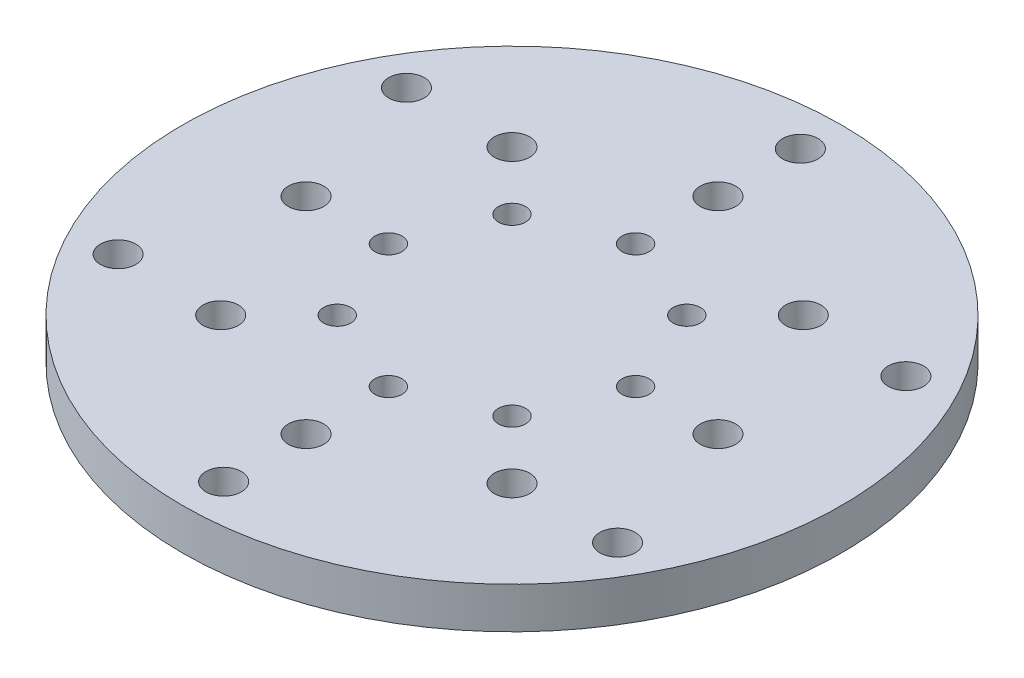
from build123d import *

# Parameters (mm, degrees)
SKETCH_1_R      = 40
SKETCH_1_R_2    = 2.15
SKETCH_1_R_3    = 1.65
EXTRUDE_2_DEPTH = 5


with BuildPart() as part:
    # 草图1 → 凸台-拉伸2 (new body)
    with BuildSketch(Plane(origin=(0, 0, 0), x_dir=(1, 0, 0), z_dir=(0, 1, 0))):
        with Locations(Location((0, 0, 0), (0, 0, 270))):
            Circle(SKETCH_1_R)
        with Locations(Location((0, 35, 0), (0, 0, 270))):
            Circle(SKETCH_1_R_2, mode=Mode.SUBTRACT)
        with Locations(Location((30.310889132, 17.5, 0), (0, 0, 270))):
            Circle(SKETCH_1_R_2, mode=Mode.SUBTRACT)
        with Locations(Location((30.310889132, -17.5, 0), (0, 0, 270))):
            Circle(SKETCH_1_R_2, mode=Mode.SUBTRACT)
        with Locations(Location((0, -35, 0), (0, 0, 270))):
            Circle(SKETCH_1_R_2, mode=Mode.SUBTRACT)
        with Locations(Location((-30.310889132, -17.5, 0), (0, 0, 270))):
            Circle(SKETCH_1_R_2, mode=Mode.SUBTRACT)
        with Locations(Location((-30.310889132, 17.5, 0), (0, 0, 270))):
            Circle(SKETCH_1_R_2, mode=Mode.SUBTRACT)
        with Locations(Location((0, 25, 0), (0, 0, 270))):
            Circle(SKETCH_1_R_2, mode=Mode.SUBTRACT)
        with Locations(Location((17.67766953, 17.67766953, 0), (0, 0, 270))):
            Circle(SKETCH_1_R_2, mode=Mode.SUBTRACT)
        with Locations(Location((25, 0, 0), (0, 0, 270))):
            Circle(SKETCH_1_R_2, mode=Mode.SUBTRACT)
        with Locations(Location((17.67766953, -17.67766953, 0), (0, 0, 270))):
            Circle(SKETCH_1_R_2, mode=Mode.SUBTRACT)
        with Locations(Location((0, -25, 0), (0, 0, 270))):
            Circle(SKETCH_1_R_2, mode=Mode.SUBTRACT)
        with Locations(Location((-17.67766953, -17.67766953, 0), (0, 0, 270))):
            Circle(SKETCH_1_R_2, mode=Mode.SUBTRACT)
        with Locations(Location((-25, 0, 0), (0, 0, 270))):
            Circle(SKETCH_1_R_2, mode=Mode.SUBTRACT)
        with Locations(Location((-17.67766953, 17.67766953, 0), (0, 0, 270))):
            Circle(SKETCH_1_R_2, mode=Mode.SUBTRACT)
        with Locations(Location((0, 15, 0), (0, 0, 270))):
            Circle(SKETCH_1_R_3, mode=Mode.SUBTRACT)
        with Locations(Location((10.606601718, 10.606601718, 0), (0, 0, 270))):
            Circle(SKETCH_1_R_3, mode=Mode.SUBTRACT)
        with Locations(Location((15, 0, 0), (0, 0, 270))):
            Circle(SKETCH_1_R_3, mode=Mode.SUBTRACT)
        with Locations(Location((10.606601718, -10.606601718, 0), (0, 0, 270))):
            Circle(SKETCH_1_R_3, mode=Mode.SUBTRACT)
        with Locations(Location((0, -15, 0), (0, 0, 270))):
            Circle(SKETCH_1_R_3, mode=Mode.SUBTRACT)
        with Locations(Location((-10.606601718, -10.606601718, 0), (0, 0, 270))):
            Circle(SKETCH_1_R_3, mode=Mode.SUBTRACT)
        with Locations(Location((-15, 0, 0), (0, 0, 270))):
            Circle(SKETCH_1_R_3, mode=Mode.SUBTRACT)
        with Locations(Location((-10.606601718, 10.606601718, 0), (0, 0, 270))):
            Circle(SKETCH_1_R_3, mode=Mode.SUBTRACT)
    extrude(amount=EXTRUDE_2_DEPTH)


solid = part.part
